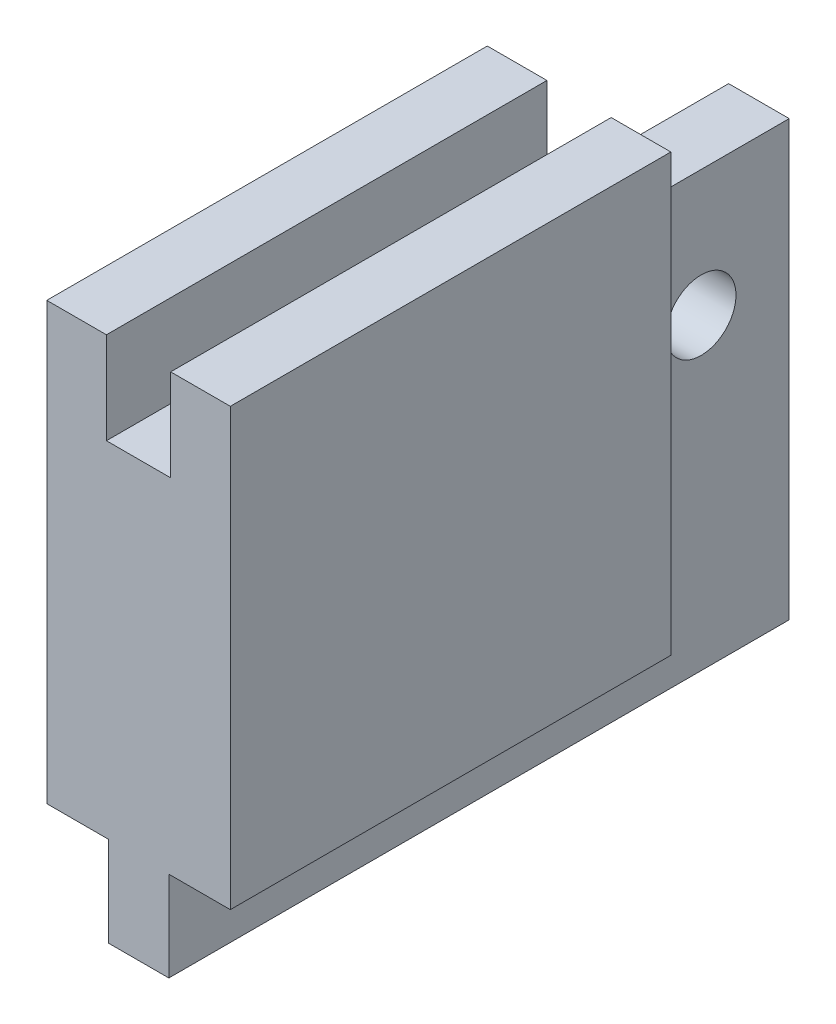
from build123d import *

# Parameters (mm, degrees)
SKETCH1_W           = 23.75
SKETCH1_H           = 24
BOSS_EXTRUDE1_DEPTH = 10
SKETCH2_W           = 3.3
SKETCH2_H           = 9.8
BOSS_EXTRUDE2_DEPTH = 23.75
SKETCH3_W           = 3.3
SKETCH3_H           = 17.3
SKETCH3_H_2         = 3.35
SKETCH3_H_3         = 13.15
BOSS_EXTRUDE3_DEPTH = 4.9
CUT_EXTRUDE1_REACH  = 36.413
SKETCH4_R           = 1.9
SKETCH5_W           = 3.5
SKETCH5_H           = 17.5
SKETCH5_H_2         = 3.25
SKETCH5_H_3         = 13.05
CUT_EXTRUDE2_DEPTH  = 5


with BuildPart() as part:
    # Sketch1 → Boss-Extrude1 (new body)
    with BuildSketch(Plane.YZ):
        with Locations((11.875, 12)):
            Rectangle(SKETCH1_W, SKETCH1_H)
    extrude(amount=-BOSS_EXTRUDE1_DEPTH)

    # Sketch2 → Boss-Extrude2 (add, through all)
    with BuildSketch(Plane.XZ):
        with Locations((-5, -4.9)):
            Rectangle(SKETCH2_W, SKETCH2_H)
    extrude(amount=-BOSS_EXTRUDE2_DEPTH)

    # Sketch3 → Boss-Extrude3 (add)
    with BuildSketch(Plane.XZ):
        with Locations((-5, 12)):
            Rectangle(SKETCH3_W, SKETCH3_H)
        with Locations((-5, 22.325)):
            Rectangle(SKETCH3_W, SKETCH3_H_2)
        with Locations((-5, -3.225)):
            Rectangle(SKETCH3_W, SKETCH3_H_3)
    extrude(amount=BOSS_EXTRUDE3_DEPTH)

    # Sketch4 → Cut-Extrude1 (cut, up to next)
    with BuildSketch(Plane(origin=(-6.65, 0, 0), x_dir=(0, -1, 0), z_dir=(-1, 0, 0)), mode=Mode.PRIVATE) as cut_extrude1_sk1:
        with Locations(Location((-11.875, -5, 0), (0, 0, 90))):
            Circle(SKETCH4_R)
    cut_extrude1_tool1 = extrude(cut_extrude1_sk1.sketch, amount=-CUT_EXTRUDE1_REACH, mode=Mode.PRIVATE) & part.part
    add(cut_extrude1_tool1.solids().sort_by_distance((-6.65, 11.875, -5))[0], mode=Mode.SUBTRACT)

    # Sketch5 → Cut-Extrude2 (cut)
    with BuildSketch(Plane(origin=(0, 23.75, 0), x_dir=(-1, 0, 0), z_dir=(0, 1, 0))):
        with Locations((5, 12)):
            Rectangle(SKETCH5_W, SKETCH5_H)
        with Locations((5, 22.375)):
            Rectangle(SKETCH5_W, SKETCH5_H_2)
        with Locations((5, -3.275)):
            Rectangle(SKETCH5_W, SKETCH5_H_3)
    extrude(amount=-CUT_EXTRUDE2_DEPTH, mode=Mode.SUBTRACT)


solid = part.part
